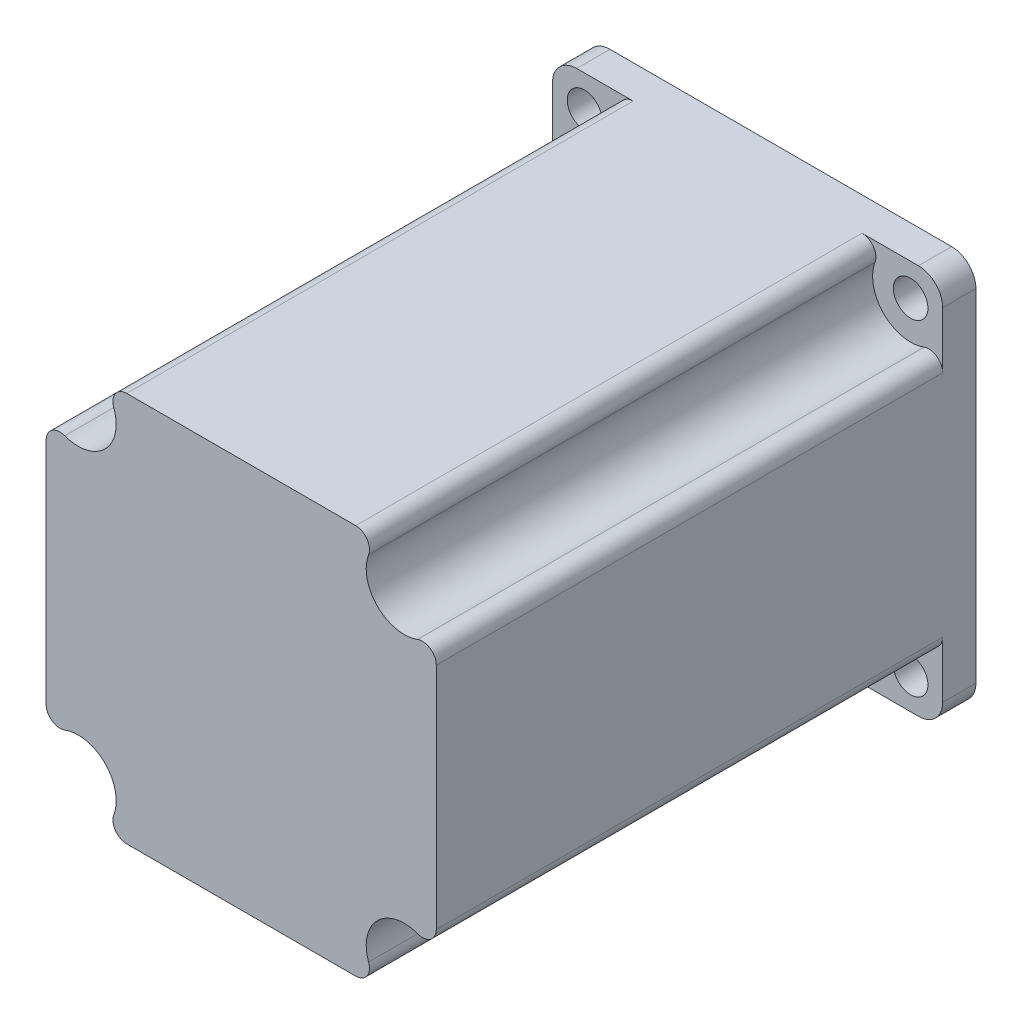
from build123d import *

# Parameters (mm, degrees)
SKETCH1_W           = 56.4
SKETCH1_H           = 56.4
BOSS_EXTRUDE1_DEPTH = 78
FILLET1_R           = 3.5
SKETCH2_R           = 19.05
BOSS_EXTRUDE2_DEPTH = 1.6
SKETCH4_R           = 3.175
BOSS_EXTRUDE3_DEPTH = 20.6
SKETCH5_R           = 2.5
CUT_EXTRUDE1_DEPTH  = 112.561283607
CUT_EXTRUDE2_START  = -73.2
SKETCH8_R           = 5.5
CUT_EXTRUDE2_DEPTH  = 73.2
FILLET2_R           = 2


with BuildPart() as part:
    # Sketch1 → Boss-Extrude1 (new body)
    with BuildSketch(Plane.XY):
        with Locations((28.2, 28.2)):
            Rectangle(SKETCH1_W, SKETCH1_H)
    extrude(amount=BOSS_EXTRUDE1_DEPTH)

    # Fillet1
    fillet1_edges = [part.edges().sort_by_distance(p)[0] for p in [
        (0, 56.4, 39),
        (56.4, 56.4, 39),
        (56.4, 0, 39),
        (0, 0, 39),
    ]]
    fillet(fillet1_edges, radius=FILLET1_R)

    # Sketch2 → Boss-Extrude2 (add)
    with BuildSketch(Plane(origin=(0, 0, 0), x_dir=(-1, 0, 0), z_dir=(0, 0, -1))):
        with Locations(Location((-28.2, 28.2, 0), (0, 0, 180))):
            Circle(SKETCH2_R)
    extrude(amount=BOSS_EXTRUDE2_DEPTH)

    # Sketch4 → Boss-Extrude3 (add)
    with BuildSketch(Plane(origin=(0, 0, 0), x_dir=(-1, 0, 0), z_dir=(0, 0, -1))):
        with Locations(Location((-28.2, 28.2, 0), (0, 0, 180))):
            Circle(SKETCH4_R)
    extrude(amount=BOSS_EXTRUDE3_DEPTH)

    # Sketch5 → Cut-Extrude1 (cut, through all)
    with BuildSketch(Plane(origin=(0, 0, 0), x_dir=(-1, 0, 0), z_dir=(0, 0, -1))):
        with Locations((-51.77, 51.77)):
            Circle(SKETCH5_R)
        with Locations((-4.63, 51.77)):
            Circle(SKETCH5_R)
        with Locations((-4.63, 4.63)):
            Circle(SKETCH5_R)
        with Locations((-51.77, 4.63)):
            Circle(SKETCH5_R)
    extrude(amount=-CUT_EXTRUDE1_DEPTH, mode=Mode.SUBTRACT)

    # Sketch8 → Cut-Extrude2 (cut)
    with BuildSketch(Plane.XY.offset(78).offset(CUT_EXTRUDE2_START)):
        with Locations((4.63, 51.77)):
            Circle(SKETCH8_R)
        with Locations((51.77, 51.77)):
            Circle(SKETCH8_R)
        with Locations((51.77, 4.63)):
            Circle(SKETCH8_R)
        with Locations((4.63, 4.63)):
            Circle(SKETCH8_R)
    extrude(amount=CUT_EXTRUDE2_DEPTH, mode=Mode.SUBTRACT)

    # Fillet2
    fillet2_edges = [part.edges().sort_by_distance(p)[0] for p in [
        (0, 7.598686578, 41.4),
        (7.598686578, 0, 41.4),
        (0, 48.801313422, 41.4),
        (7.598686578, 56.4, 41.4),
        (56.4, 48.801313422, 41.4),
        (48.801313422, 56.4, 41.4),
        (48.801313422, 0, 41.4),
        (56.4, 7.598686578, 41.4),
    ]]
    fillet(fillet2_edges, radius=FILLET2_R)


solid = part.part
